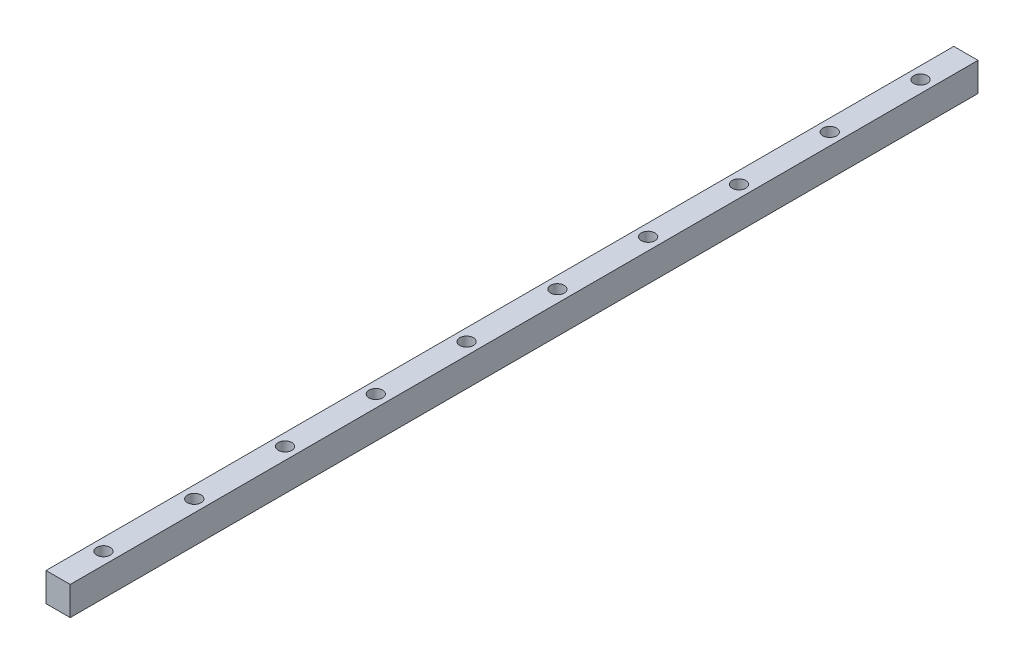
from build123d import *

# Parameters (mm, degrees)
SKETCH1_W           = 8
SKETCH1_H           = 9.5
BOSS_EXTRUDE1_DEPTH = 300
SKETCH2_R           = 2.25
CUT_EXTRUDE1_DEPTH  = 301.1770311
LPATTERN1_COUNT     = 10
LPATTERN1_PITCH     = 30


with BuildPart() as part:
    # Sketch1 → Boss-Extrude1 (new body)
    with BuildSketch(Plane.XY):
        Rectangle(SKETCH1_W, SKETCH1_H)
    extrude(amount=BOSS_EXTRUDE1_DEPTH)

    # Sketch2 → Cut-Extrude1 (cut, through all)
    with BuildSketch(Plane(origin=(0, 4.75, 0), x_dir=(1, 0, 0), z_dir=(0, 1, 0))):
        with Locations(Location((0, -15, 0), (0, 0, 270))):
            Circle(SKETCH2_R)
    cut_extrude1 = extrude(amount=-CUT_EXTRUDE1_DEPTH, mode=Mode.SUBTRACT)

    # LPattern1: Cut-Extrude1 ×10
    with Locations(*[(0, 0, i * LPATTERN1_PITCH) for i in range(1, LPATTERN1_COUNT)]):
        add(cut_extrude1, mode=Mode.SUBTRACT)


solid = part.part
